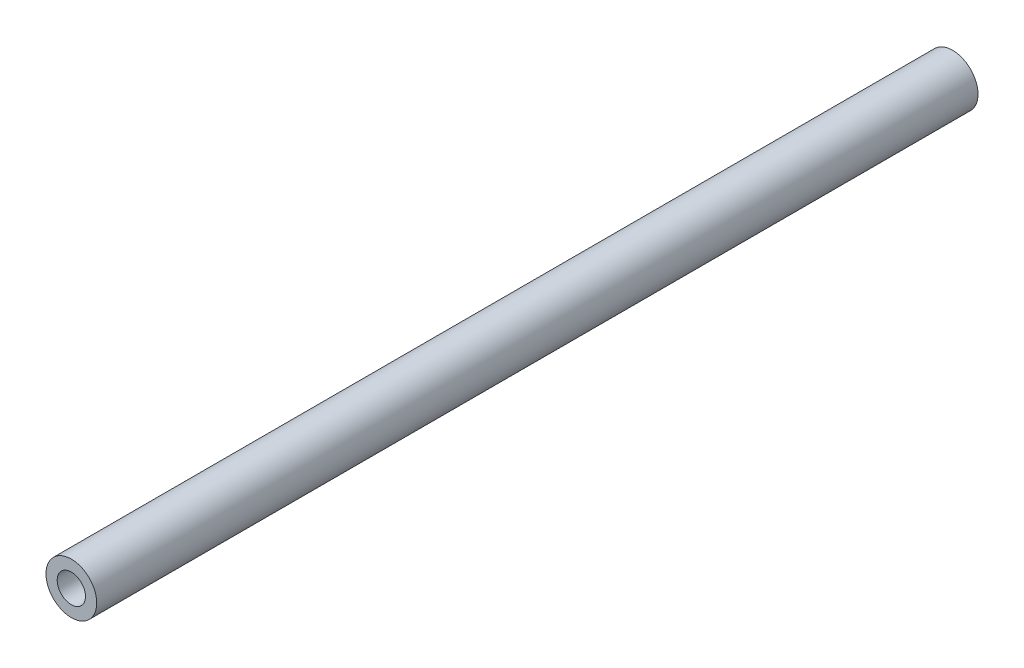
from build123d import *

# Parameters (mm, degrees)
SKETCH32_R          = 8.55
SKETCH32_R_2        = 4.765
BOSS_EXTRUDE1_DEPTH = 296.85


with BuildPart() as part:
    # Sketch32 → Boss-Extrude1 (new body)
    with BuildSketch(Plane.XY):
        Circle(SKETCH32_R)
        Circle(SKETCH32_R_2, mode=Mode.SUBTRACT)
    extrude(amount=BOSS_EXTRUDE1_DEPTH)


solid = part.part
